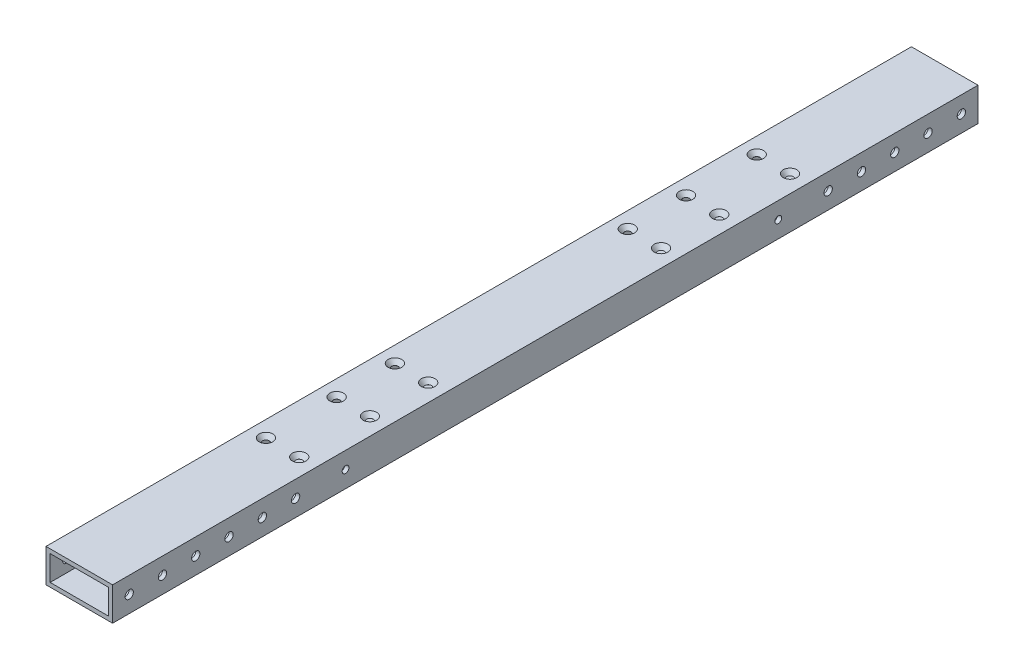
from build123d import *

# Parameters (mm, degrees)
BOSS_EXTRUDE1_DEPTH              = 330.2
BOSS_EXTRUDE1_DEPTH_BACK         = 330.2
SKETCH3_W                        = 50.8
SKETCH3_H                        = 25.4
SKETCH3_W_2                      = 44.45
SKETCH3_H_2                      = 19.05
F_1_4_0_25_DIAMETER_HOLE3_D      = 6.35
F_1_4_0_25_DIAMETER_HOLE4_D      = 6.35
F_1_4_0_25_DIAMETER_HOLE5_D      = 6.35
F_1_4_0_25_DIAMETER_HOLE6_D      = 6.35
F_1_4_0_25_DIAMETER_HOLE7_D      = 6.35
F_1_4_0_25_DIAMETER_HOLE8_D      = 6.35
F_13_64_0_20313_DIAMETER_HOLE1_D = 5.159502
F_1_2_0_5_DIAMETER_HOLE1_D       = 12.7
F_1_2_0_5_DIAMETER_HOLE1_DEPTH   = 6.35
F_1_2_0_5_DIAMETER_HOLE1_TIP     = 3.815464931
F_10_CLEARANCE_HOLE1_AT_2_COUNT  = 2
F_10_CLEARANCE_HOLE1_AT_2_PITCH  = 25.4
F_10_CLEARANCE_HOLE1_AT_3_COUNT  = 2
F_10_CLEARANCE_HOLE1_AT_3_PITCH  = 51.195336702
F_10_CLEARANCE_HOLE1_AT_4_COUNT  = 2
F_10_CLEARANCE_HOLE1_AT_4_PITCH  = 44.45
F_10_CLEARANCE_HOLE1_AT_5_COUNT  = 2
F_10_CLEARANCE_HOLE1_AT_5_PITCH  = 223.596969524
F_10_CLEARANCE_HOLE1_AT_6_COUNT  = 2
F_10_CLEARANCE_HOLE1_AT_6_PITCH  = 222.1496
F_10_CLEARANCE_HOLE1_AT_7_COUNT  = 2
F_10_CLEARANCE_HOLE1_AT_7_PITCH  = 266.5996
F_10_CLEARANCE_HOLE1_AT_8_COUNT  = 2
F_10_CLEARANCE_HOLE1_AT_8_PITCH  = 267.806845917
F_10_CLEARANCE_HOLE1_AT_9_COUNT  = 2
F_10_CLEARANCE_HOLE1_AT_9_PITCH  = 59.652834174
F_10_CLEARANCE_HOLE1_AT_10_COUNT = 2
F_10_CLEARANCE_HOLE1_AT_10_PITCH = 53.975
F_10_CLEARANCE_HOLE1_AT_11_COUNT = 2
F_10_CLEARANCE_HOLE1_AT_11_PITCH = 321.579281306
F_10_CLEARANCE_HOLE1_AT_12_COUNT = 2
F_10_CLEARANCE_HOLE1_AT_12_PITCH = 320.5746


with BuildPart() as part:
    # Sketch3 → Boss-Extrude1 (new, two sides: drawn at the far end of the back side and taken through both)
    with BuildSketch(Plane.XY.offset(-BOSS_EXTRUDE1_DEPTH_BACK)):
        Rectangle(SKETCH3_W, SKETCH3_H)
        Rectangle(SKETCH3_W_2, SKETCH3_H_2, mode=Mode.SUBTRACT)
    extrude(amount=BOSS_EXTRUDE1_DEPTH + BOSS_EXTRUDE1_DEPTH_BACK)

    # 1/4 (0.25) Diameter Hole3 (through all)
    with Locations(Plane.ZY.offset(25.4)):
        with Locations((-317.5, 0)):
            Hole(F_1_4_0_25_DIAMETER_HOLE3_D / 2)

    # 1/4 (0.25) Diameter Hole4 (through all)
    with Locations(Plane.ZY.offset(25.4)):
        with Locations((292.1, 0), (317.5, 0)):
            Hole(F_1_4_0_25_DIAMETER_HOLE4_D / 2)

    # 1/4 (0.25) Diameter Hole5 (through all)
    with Locations(Plane(origin=(25.4, 0, 0), x_dir=(0, 0, -1), z_dir=(1, 0, 0))):
        with Locations((292.1, 0), (266.7, 0)):
            Hole(F_1_4_0_25_DIAMETER_HOLE5_D / 2)

    # 1/4 (0.25) Diameter Hole6 (through all)
    with Locations(Plane(origin=(25.4, 0, 0), x_dir=(0, 0, -1), z_dir=(1, 0, 0))):
        with Locations((215.9, 0), (241.3, 0)):
            Hole(F_1_4_0_25_DIAMETER_HOLE6_D / 2)

    # 1/4 (0.25) Diameter Hole7 (through all)
    with Locations(Plane(origin=(25.4, 0, 0), x_dir=(0, 0, -1), z_dir=(1, 0, 0))):
        with Locations((-190.5, 0), (-215.9, 0)):
            Hole(F_1_4_0_25_DIAMETER_HOLE7_D / 2)

    # 1/4 (0.25) Diameter Hole8 (through all)
    with Locations(Plane(origin=(25.4, 0, 0), x_dir=(0, 0, -1), z_dir=(1, 0, 0))):
        with Locations((-266.7, 0), (-241.3, 0)):
            Hole(F_1_4_0_25_DIAMETER_HOLE8_D / 2)

    # 13/64 (0.20313) Diameter Hole1 (through all)
    with Locations(Plane(origin=(25.4, 0, 0), x_dir=(0, 0, -1), z_dir=(1, 0, 0))):
        with Locations((-152.4, 0), (177.8, 0)):
            Hole(F_13_64_0_20313_DIAMETER_HOLE1_D / 2)

    # 1/2 (0.5) Diameter Hole1
    with Locations(Plane.ZY.offset(25.4)):
        with Locations((-146.050000508, 4.9e-08), (120.65, 1.7e-08)):
            Hole(F_1_2_0_5_DIAMETER_HOLE1_D / 2, depth=F_1_2_0_5_DIAMETER_HOLE1_DEPTH)
            with Locations((0, 0, -(F_1_2_0_5_DIAMETER_HOLE1_DEPTH + F_1_2_0_5_DIAMETER_HOLE1_TIP / 2))):  # 118° drill point
                Cone(0, F_1_2_0_5_DIAMETER_HOLE1_D / 2, F_1_2_0_5_DIAMETER_HOLE1_TIP, mode=Mode.SUBTRACT)

    # Sketch40 → #10 Clearance Hole1 (revolve, cut)
    with BuildSketch(Plane(origin=(-13.208, -12.7, -145.9998), x_dir=(0, 0, -1), z_dir=(1, 0, 0))):
        Polygon((0, 0), (0, 25.4), (5.2197, 25.4), (2.4892, 22.258919064), (2.4892, 0), align=None)
    f_10_clearance_hole1 = revolve(axis=Axis((-13.208, -19.05, -145.9998), (0, 1, 0)), mode=Mode.SUBTRACT)

    # #10 Clearance Hole1 at 2: #10 Clearance Hole1 ×2
    with Locations(*[(i * F_10_CLEARANCE_HOLE1_AT_2_PITCH, 0, 0) for i in range(1, F_10_CLEARANCE_HOLE1_AT_2_COUNT)]):
        add(f_10_clearance_hole1, mode=Mode.SUBTRACT)

    # #10 Clearance Hole1 at 3: #10 Clearance Hole1 ×2
    with Locations(*[Vector(0.4961389383568339, 0, 0.8682431421244592) * (i * F_10_CLEARANCE_HOLE1_AT_3_PITCH) for i in range(1, F_10_CLEARANCE_HOLE1_AT_3_COUNT)]):
        add(f_10_clearance_hole1, mode=Mode.SUBTRACT)

    # #10 Clearance Hole1 at 4: #10 Clearance Hole1 ×2
    with Locations(*[(0, 0, i * F_10_CLEARANCE_HOLE1_AT_4_PITCH) for i in range(1, F_10_CLEARANCE_HOLE1_AT_4_COUNT)]):
        add(f_10_clearance_hole1, mode=Mode.SUBTRACT)

    # #10 Clearance Hole1 at 5: #10 Clearance Hole1 ×2
    with Locations(*[Vector(0.11359724621542588, 0, 0.9935268821991039) * (i * F_10_CLEARANCE_HOLE1_AT_5_PITCH) for i in range(1, F_10_CLEARANCE_HOLE1_AT_5_COUNT)]):
        add(f_10_clearance_hole1, mode=Mode.SUBTRACT)

    # #10 Clearance Hole1 at 6: #10 Clearance Hole1 ×2
    with Locations(*[(0, 0, i * F_10_CLEARANCE_HOLE1_AT_6_PITCH) for i in range(1, F_10_CLEARANCE_HOLE1_AT_6_COUNT)]):
        add(f_10_clearance_hole1, mode=Mode.SUBTRACT)

    # #10 Clearance Hole1 at 7: #10 Clearance Hole1 ×2
    with Locations(*[(0, 0, i * F_10_CLEARANCE_HOLE1_AT_7_PITCH) for i in range(1, F_10_CLEARANCE_HOLE1_AT_7_COUNT)]):
        add(f_10_clearance_hole1, mode=Mode.SUBTRACT)

    # #10 Clearance Hole1 at 8: #10 Clearance Hole1 ×2
    with Locations(*[Vector(0.09484447611114118, 0, 0.9954921021038807) * (i * F_10_CLEARANCE_HOLE1_AT_8_PITCH) for i in range(1, F_10_CLEARANCE_HOLE1_AT_8_COUNT)]):
        add(f_10_clearance_hole1, mode=Mode.SUBTRACT)

    # #10 Clearance Hole1 at 9: #10 Clearance Hole1 ×2
    with Locations(*[Vector(0.4257970363298798, 0, -0.904818702200994) * (i * F_10_CLEARANCE_HOLE1_AT_9_PITCH) for i in range(1, F_10_CLEARANCE_HOLE1_AT_9_COUNT)]):
        add(f_10_clearance_hole1, mode=Mode.SUBTRACT)

    # #10 Clearance Hole1 at 10: #10 Clearance Hole1 ×2
    with Locations(*[(0, 0, -i * F_10_CLEARANCE_HOLE1_AT_10_PITCH) for i in range(1, F_10_CLEARANCE_HOLE1_AT_10_COUNT)]):
        add(f_10_clearance_hole1, mode=Mode.SUBTRACT)

    # #10 Clearance Hole1 at 11: #10 Clearance Hole1 ×2
    with Locations(*[Vector(0.07898518802847557, 0, 0.9968757896910259) * (i * F_10_CLEARANCE_HOLE1_AT_11_PITCH) for i in range(1, F_10_CLEARANCE_HOLE1_AT_11_COUNT)]):
        add(f_10_clearance_hole1, mode=Mode.SUBTRACT)

    # #10 Clearance Hole1 at 12: #10 Clearance Hole1 ×2
    with Locations(*[(0, 0, i * F_10_CLEARANCE_HOLE1_AT_12_PITCH) for i in range(1, F_10_CLEARANCE_HOLE1_AT_12_COUNT)]):
        add(f_10_clearance_hole1, mode=Mode.SUBTRACT)


solid = part.part
